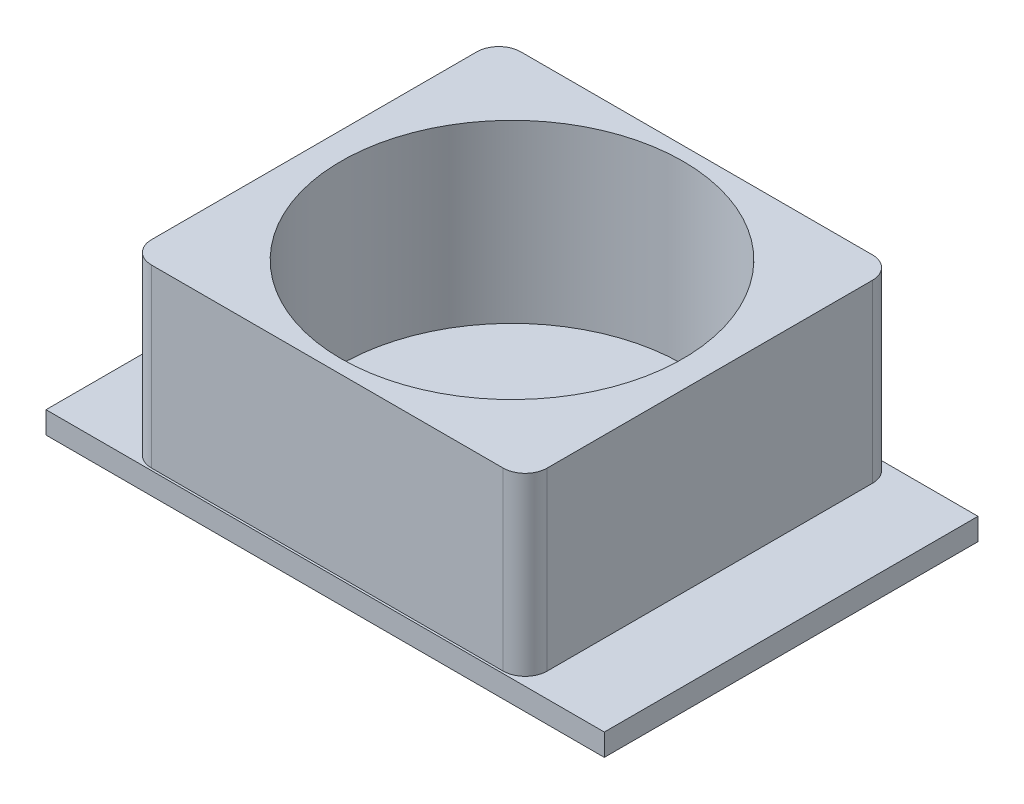
from build123d import *

# Parameters (mm, degrees)
SKETCH2_W           = 90
SKETCH2_H           = 84
SKETCH2_R           = 38.9
BOSS_EXTRUDE1_DEPTH = 40
SKETCH3_W           = 127
SKETCH3_H           = 85
BOSS_EXTRUDE2_DEPTH = 5
FILLET1_R           = 5


with BuildPart() as part:
    # Sketch2 → Boss-Extrude1 (new body)
    with BuildSketch(Plane(origin=(0, 0, 0), x_dir=(1, 0, 0), z_dir=(0, 1, 0))):
        with Locations((45, 42)):
            Rectangle(SKETCH2_W, SKETCH2_H)
        with Locations(Location((45, 42, 0), (0, 0, 270))):
            Circle(SKETCH2_R, mode=Mode.SUBTRACT)
    extrude(amount=BOSS_EXTRUDE1_DEPTH)

    # Sketch3 → Boss-Extrude2 (add)
    with BuildSketch(Plane.XZ):
        with Locations((45, -42)):
            Rectangle(SKETCH3_W, SKETCH3_H)
    extrude(amount=BOSS_EXTRUDE2_DEPTH)

    # Fillet1
    fillet1_edges = [part.edges().sort_by_distance(p)[0] for p in [
        (0, 20, -84),
        (90, 20, -84),
        (90, 20, 0),
        (0, 20, 0),
    ]]
    fillet(fillet1_edges, radius=FILLET1_R)


solid = part.part
